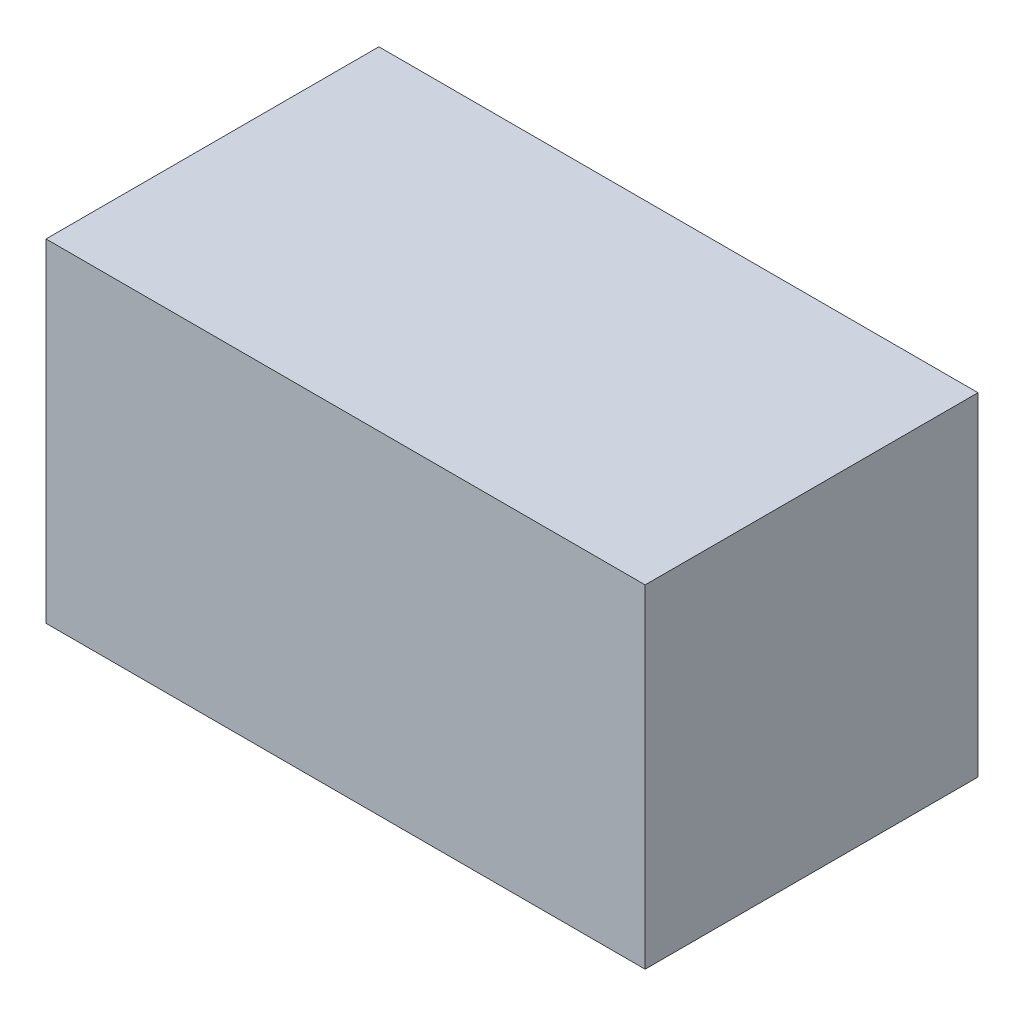
from build123d import *

# Parameters (mm, degrees)
SKETCH_1_W      = 180
SKETCH_1_H      = 100
EXTRUDE_1_DEPTH = 100


with BuildPart() as part:
    # 草图1 → 凸台-拉伸1 (new body)
    with BuildSketch(Plane(origin=(0, 0, 0), x_dir=(1, 0, 0), z_dir=(0, 1, 0))):
        with Locations((-7.949886105, -7.175398633)):
            Rectangle(SKETCH_1_W, SKETCH_1_H)
    extrude(amount=EXTRUDE_1_DEPTH)


solid = part.part
